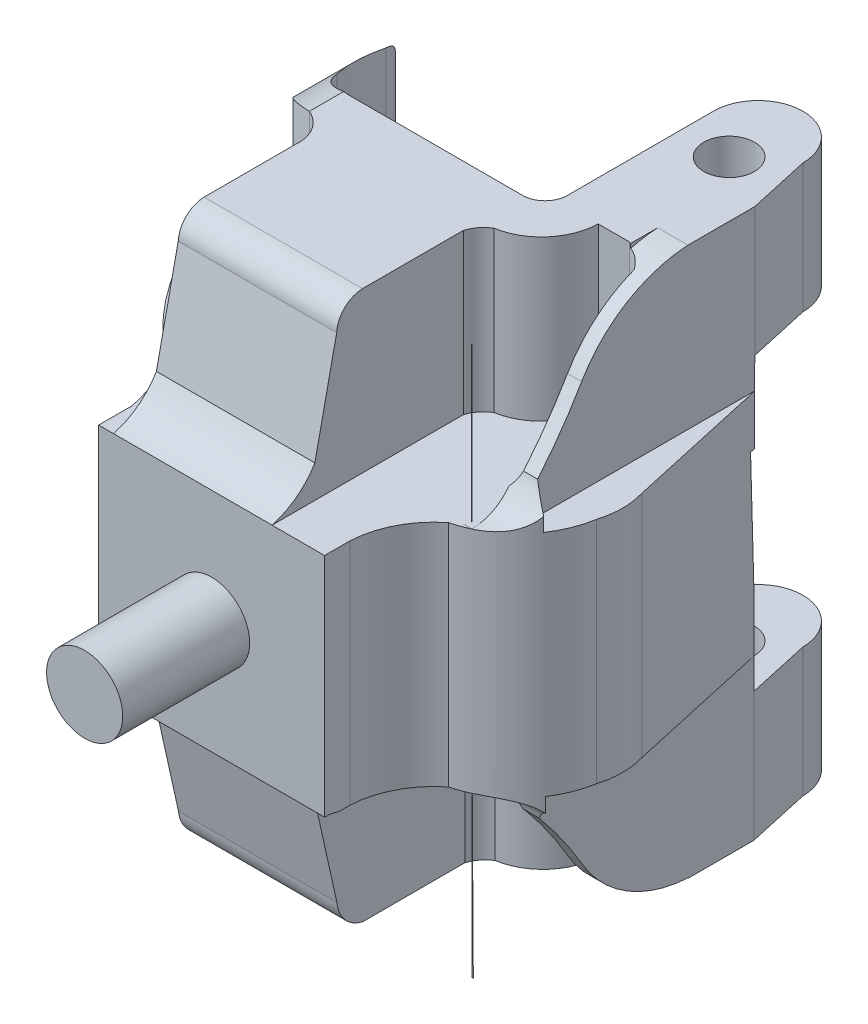
from build123d import *

# Parameters (mm, degrees)
BOSS_EXTRUDE1_DEPTH      = 431.8
CUT_EXTRUDE1_DEPTH       = 190.5
CUT_EXTRUDE1_DEPTH_BACK  = 190.5
CUT_EXTRUDE2_DEPTH       = 125.73
CUT_EXTRUDE4_DEPTH       = 128.27
CUT_EXTRUDE4_DEPTH_BACK  = 120.65
CUT_EXTRUDE5_DEPTH       = 125.73
CUT_EXTRUDE7_DEPTH       = 161.29
CUT_EXTRUDE8_DEPTH       = 45.72
CUT_EXTRUDE9_DEPTH       = 104.14
CUT_EXTRUDE9_DEPTH_BACK  = 88.9
SKETCH12_R               = 20
CUT_EXTRUDE10_DEPTH      = 431.8
CUT_EXTRUDE11_DEPTH      = 76.2
CUT_EXTRUDE11_DEPTH_BACK = 88.9
SCALE1_SCALE             = 0.1
SKETCH15_W               = 19.461471877
SKETCH15_H               = 23.114052007
CUT_EXTRUDE12_DEPTH      = 38.04
SKETCH16_R               = 3
BOSS_EXTRUDE3_DEPTH      = 10


with BuildPart() as part:
    # Sketch2 → Boss-Extrude1 (new body)
    with BuildSketch(Plane(origin=(0, 0, 0), x_dir=(1, 0, 0), z_dir=(0, 1, 0))):
        with BuildLine():
            Line((-79.244298522, 0), (55.440912384, 0))
            ThreePointArc((55.440912384, 0), (68.327741041, 4.288291197), (74.467971072, 16.4026368))
            Line((74.467971072, 16.4026368), (74.467971072, 72.827707392))
            Line((74.467971072, 72.827707392), (74.467971072, 132.581872657))
            ThreePointArc((74.467971072, 132.581872657), (109.746022134, 167.859923719), (145.024073196, 132.581872657))
            Line((145.024073196, 132.581872657), (181.17312, -30.23334015))
            ThreePointArc((181.17312, -30.23334015), (183.82679773, -48.184385864), (181.17312, -66.135431578))
            ThreePointArc((181.17312, -66.135431578), (162.228077841, -104.747606276), (125.184924058, -126.602111877))
            ThreePointArc((125.184924058, -126.602111877), (106.407786564, -149.335868365), (98.730751427, -177.804582912))
            Line((98.730751427, -177.804582912), (98.730751427, -544.478753158))
            Line((98.730751427, -544.478753158), (106.407786564, -544.478753158))
            Line((106.407786564, -544.478753158), (106.407786564, -578.332354391))
            Line((106.407786564, -578.332354391), (-88.206932207, -578.332354391))
            Line((-88.206932207, -578.332354391), (-88.206932207, -544.478753158))
            Line((-88.206932207, -544.478753158), (-79.244298522, -544.478753158))
            Line((-79.244298522, -544.478753158), (-79.244298522, -171.952122102))
            ThreePointArc((-79.244298522, -171.952122102), (-88.206932207, -144.660352565), (-104.399502705, -120.933360599))
            ThreePointArc((-104.399502705, -120.933360599), (-152.176796458, -66.428157812), (-181.17312, 0))
            ThreePointArc((-181.17312, 0), (-181.323655947, 48.230174732), (-174.314101801, 95.9485))
            ThreePointArc((-174.314101801, 95.9485), (-170.720922927, 102.895856482), (-163.921391124, 106.761482404))
            ThreePointArc((-163.921391124, 106.761482404), (-145.58136446, 101.830499971), (-136.054979803, 85.401283278))
            ThreePointArc((-136.054979803, 85.401283278), (-126.311948352, 53.883000562), (-113.17819392, 23.620262719))
            ThreePointArc((-113.17819392, 23.620262719), (-99.916901574, 6.486425919), (-79.244298522, 0))
        make_face()
    extrude(amount=BOSS_EXTRUDE1_DEPTH)

    # Sketch3 → Cut-Extrude1 (cut, two sides: drawn at the far end of the back side and taken through both)
    with BuildSketch(Plane(origin=(0, 0, 0), x_dir=(0, 0, -1), z_dir=(1, 0, 0)).offset(-CUT_EXTRUDE1_DEPTH_BACK)):
        with BuildLine():
            Line((-204.28108922, 127), (-544.478753158, 127))
            Line((-544.478753158, 127), (-544.478753158, 100.52839733))
            Line((-544.478753158, 100.52839733), (-578.332354391, 100.52839733))
            Line((-578.332354391, 100.52839733), (-578.332354391, 0))
            Line((-578.332354391, 0), (-126.602111877, 0))
            ThreePointArc((-126.602111877, 0), (-140.566602846, 8.233208943), (-146.973522261, 23.12428416))
            Line((-146.973522261, 23.12428416), (-164.165792349, 100.52839733))
            ThreePointArc((-164.165792349, 100.52839733), (-178.868176776, 121.87961231), (-204.28108922, 127))
        make_face()
        with BuildLine():
            Line((-204.28108922, 304.8), (-544.478753158, 304.8))
            Line((-544.478753158, 304.8), (-544.478753158, 331.668917397))
            Line((-544.478753158, 331.668917397), (-578.332354391, 331.668917397))
            Line((-578.332354391, 331.668917397), (-578.332354391, 431.8))
            Line((-578.332354391, 431.8), (-126.602111877, 431.8))
            ThreePointArc((-126.602111877, 431.8), (-140.684053109, 425.838191425), (-146.973522261, 411.89951114))
            Line((-146.973522261, 411.89951114), (-164.165792349, 331.668917397))
            ThreePointArc((-164.165792349, 331.668917397), (-181.197219127, 313.716309403), (-204.28108922, 304.8))
        make_face()
    extrude(amount=CUT_EXTRUDE1_DEPTH + CUT_EXTRUDE1_DEPTH_BACK, mode=Mode.SUBTRACT)

    # Sketch4 → Cut-Extrude2 (cut)
    with BuildSketch(Plane(origin=(0, 431.8, 0), x_dir=(1, 0, 0), z_dir=(0, 1, 0))):
        Polygon((155.84555549, -87.211031478), (155.84555549, 83.841944542), (226.394952987, -1.684543468), (177.876923144, -101.374053541), align=None)
        with BuildLine():
            Line((57.318052164, -164.165792349), (57.318052164, -47.130284905))
            ThreePointArc((57.318052164, -47.130284905), (61.348404683, -39.477358819), (67.773769346, -33.687219957))
            ThreePointArc((67.773769346, -33.687219957), (94.808127688, -18.527489601), (106.050536967, 10.356453845))
            Line((106.050536967, 10.356453845), (130.534952263, 10.356453845))
            ThreePointArc((130.534952263, 10.356453845), (138.616208532, 6.545433697), (144.697974326, 0))
            Line((144.697974326, 0), (144.697974326, -87.211031478))
            Line((144.697974326, -87.211031478), (138.616208532, -92.687338339))
            Line((138.616208532, -92.687338339), (138.616208532, -164.165792349))
            Line((138.616208532, -164.165792349), (138.616208532, -204.28108922))
            Line((138.616208532, -204.28108922), (57.318052164, -204.28108922))
            Line((57.318052164, -204.28108922), (57.318052164, -164.165792349))
        make_face()
        with BuildLine():
            Line((-174.314101801, 95.9485), (-160.803012267, 93.363428502))
            ThreePointArc((-160.803012267, 93.363428502), (-150.960378938, 80.465137541), (-146.941851349, 64.745888939))
            ThreePointArc((-146.941851349, 64.745888939), (-140.774296617, 37.783553429), (-131.885618608, 11.591996185))
            ThreePointArc((-131.885618608, 11.591996185), (-111.728690537, -11.869907513), (-84.566029991, -26.666952706))
            ThreePointArc((-84.566029991, -26.666952706), (-71.496208015, -37.684459203), (-67.501620029, -54.305198138))
            Line((-67.501620029, -54.305198138), (-67.501620029, -164.165792349))
            Line((-67.501620029, -164.165792349), (-67.501620029, -204.28108922))
            Line((-67.501620029, -204.28108922), (-94.807796549, -204.28108922))
            Line((-94.807796549, -204.28108922), (-106.074933908, -164.165792349))
            Line((-106.074933908, -164.165792349), (-212.544008295, 0))
            Line((-212.544008295, 0), (-212.544008295, 95.9485))
            Line((-212.544008295, 95.9485), (-174.314101801, 95.9485))
        make_face()
    extrude(amount=-CUT_EXTRUDE2_DEPTH, mode=Mode.SUBTRACT)

    # Sketch6 → Cut-Extrude4 (cut, two sides: drawn at the far end of the back side and taken through both)
    with BuildSketch(Plane.XY.offset(-CUT_EXTRUDE4_DEPTH_BACK)):
        with BuildLine():
            Line((-181.17312, 306.07), (-200.286673994, 306.07))
            Line((-200.286673994, 306.07), (-200.286673994, 431.8))
            Line((-200.286673994, 431.8), (-84.566029991, 431.8))
            ThreePointArc((-84.566029991, 431.8), (-123.973907642, 408.523503999), (-146.941851349, 368.935))
            ThreePointArc((-146.941851349, 368.935), (-151.793508278, 351.084070168), (-160.803012267, 334.927860566))
            ThreePointArc((-160.803012267, 334.927860566), (-168.44948447, 318.707003198), (-181.17312, 306.07))
        make_face()
        with BuildLine():
            Line((-181.17312, 126.127314727), (-200.286673994, 126.127314727))
            Line((-200.286673994, 126.127314727), (-200.286673994, 0.397314727))
            Line((-200.286673994, 0.397314727), (-200.286673994, -9.335489314))
            Line((-200.286673994, -9.335489314), (-84.566029991, -9.335489314))
            Line((-84.566029991, -9.335489314), (-84.566029991, 0.397314727))
            ThreePointArc((-84.566029991, 0.397314727), (-123.973907642, 23.673810728), (-146.941851349, 63.262314727))
            ThreePointArc((-146.941851349, 63.262314727), (-151.793508278, 81.113244559), (-160.803012267, 97.26945416))
            ThreePointArc((-160.803012267, 97.26945416), (-168.44948447, 113.490311529), (-181.17312, 126.127314727))
        make_face()
    extrude(amount=CUT_EXTRUDE4_DEPTH + CUT_EXTRUDE4_DEPTH_BACK, mode=Mode.SUBTRACT)

    # Sketch7 → Cut-Extrude5 (cut)
    with BuildSketch(Plane(origin=(0, 0, 0), x_dir=(1, 0, 0), z_dir=(0, 1, 0))):
        Polygon((156.049496363, -86.308866012), (156.049496363, 84.744110008), (226.598893859, -0.782378002), (178.080864016, -100.471888075), align=None)
        with BuildLine():
            Line((57.521993037, -163.263626883), (57.521993037, -46.228119439))
            ThreePointArc((57.521993037, -46.228119439), (61.552345555, -38.575193353), (67.977710219, -32.785054491))
            ThreePointArc((67.977710219, -32.785054491), (95.01206856, -17.625324135), (106.25447784, 11.258619311))
            Line((106.25447784, 11.258619311), (130.738893135, 11.258619311))
            ThreePointArc((130.738893135, 11.258619311), (138.820149404, 7.447599163), (144.901915198, 0.902165466))
            Line((144.901915198, 0.902165466), (144.901915198, -86.308866012))
            Line((144.901915198, -86.308866012), (138.820149404, -91.785172873))
            Line((138.820149404, -91.785172873), (138.820149404, -163.263626883))
            Line((138.820149404, -163.263626883), (138.820149404, -203.378923754))
            Line((138.820149404, -203.378923754), (57.521993037, -203.378923754))
            Line((57.521993037, -203.378923754), (57.521993037, -163.263626883))
        make_face()
        with BuildLine():
            Line((-174.110160928, 96.850665466), (-160.599071394, 94.265593968))
            ThreePointArc((-160.599071394, 94.265593968), (-150.756438066, 81.367303007), (-146.737910477, 65.648054405))
            ThreePointArc((-146.737910477, 65.648054405), (-140.570355744, 38.685718895), (-131.681677735, 12.494161651))
            ThreePointArc((-131.681677735, 12.494161651), (-111.524749665, -10.967742047), (-84.362089119, -25.76478724))
            ThreePointArc((-84.362089119, -25.76478724), (-71.292267142, -36.782293737), (-67.297679156, -53.403032672))
            Line((-67.297679156, -53.403032672), (-67.297679156, -163.263626883))
            Line((-67.297679156, -163.263626883), (-67.297679156, -203.378923754))
            Line((-67.297679156, -203.378923754), (-94.603855676, -203.378923754))
            Line((-94.603855676, -203.378923754), (-105.870993035, -163.263626883))
            Line((-105.870993035, -163.263626883), (-212.340067422, 0.902165466))
            Line((-212.340067422, 0.902165466), (-212.340067422, 96.850665466))
            Line((-212.340067422, 96.850665466), (-174.110160928, 96.850665466))
        make_face()
    extrude(amount=CUT_EXTRUDE5_DEPTH, mode=Mode.SUBTRACT)

    # Sketch8 → Cut-Extrude7 (cut)
    with BuildSketch(Plane(origin=(0, 0, 0), x_dir=(0, 0, -1), z_dir=(1, 0, 0))):
        Polygon((167.859923719, 215.9), (167.859923719, 101.6), (82.923395382, 101.6), (83.841944542, 330.2), (167.859923719, 330.2), align=None)
    extrude(amount=CUT_EXTRUDE7_DEPTH, mode=Mode.SUBTRACT)

    # Sketch9 → Cut-Extrude8 (cut)
    with BuildSketch(Plane(origin=(177.8, 0, 0), x_dir=(0, 0, -1), z_dir=(1, 0, 0))):
        with BuildLine():
            Line((31.13006407, 431.8), (31.13006407, 493.405620114))
            Line((31.13006407, 493.405620114), (-121.748062484, 493.405620114))
            Line((-121.748062484, 493.405620114), (-121.892848155, 306.07))
            ThreePointArc((-121.892848155, 306.07), (-100.412110743, 313.016001375), (-87.211031478, 331.329944727))
            ThreePointArc((-87.211031478, 331.329944727), (-68.814678471, 355.183985364), (-52.549790031, 380.539348952))
            ThreePointArc((-52.549790031, 380.539348952), (-17.173940566, 416.721882811), (31.13006407, 431.8))
        make_face()
        with BuildLine():
            Line((-121.360940458, -61.527139811), (-121.767097148, 125.808095964))
            ThreePointArc((-121.767097148, 125.808095964), (-100.276689563, 118.892071333), (-87.050071484, 100.596563986))
            ThreePointArc((-87.050071484, 100.596563986), (-68.62045516, 76.768213208), (-52.320206679, 51.435567114))
            ThreePointArc((-52.320206679, 51.435567114), (-16.893909677, 15.302424951), (31.431084974, 0.291716314))
            Line((31.431084974, 0.291716314), (31.517037301, -61.313843839))
            Line((31.517037301, -61.313843839), (-121.360940458, -61.527139811))
        make_face()
    extrude(amount=-CUT_EXTRUDE8_DEPTH, mode=Mode.SUBTRACT)


with BuildPart() as cut_extrude8_piece_1:
    # of the separate pieces the step leaves, piece 1, a body of its own (cut_extrude8_pieces)
    add(part.part.solids().sort_by_distance((-113.17819392, 14.385260939, -23.620262719))[0])

    # Sketch10 → Cut-Extrude9 (cut, two sides: drawn at the far end of the back side and taken through both)
    with BuildSketch(Plane(origin=(0, 0, 0), x_dir=(0, 0, -1), z_dir=(1, 0, 0)).offset(-CUT_EXTRUDE9_DEPTH_BACK)):
        with BuildLine():
            Line((-428.983201738, 193.229592666), (-514.334244368, 193.275834301))
            ThreePointArc((-514.334244368, 193.275834301), (-537.128372855, 216.094675062), (-514.309532095, 238.888803549))
            Line((-514.309532095, 238.888803549), (-428.958489465, 238.842561914))
            ThreePointArc((-428.958489465, 238.842561914), (-406.164360977, 216.023721154), (-428.983201738, 193.229592666))
        make_face()
    extrude(amount=CUT_EXTRUDE9_DEPTH + CUT_EXTRUDE9_DEPTH_BACK, mode=Mode.SUBTRACT)

    # Sketch12 → Cut-Extrude10 (cut)
    with BuildSketch(Plane(origin=(0, 0, 0), x_dir=(1, 0, 0), z_dir=(0, 1, 0))):
        with Locations(Location((111.812353192, 107.656197962, 0), (0, 0, 270))):
            Circle(SKETCH12_R)
    extrude(amount=CUT_EXTRUDE10_DEPTH, mode=Mode.SUBTRACT)

    # Sketch13 → Cut-Extrude11 (cut, two sides: drawn at the far end of the back side and taken through both)
    with BuildSketch(Plane.XY.offset(-CUT_EXTRUDE11_DEPTH_BACK)):
        with BuildLine():
            Line((156.793476245, 266.763254357), (-63.998127701, 266.763254357))
            ThreePointArc((-63.998127701, 266.763254357), (-113.494417347, 215.963254357), (-63.998127701, 165.163254357))
            Line((-63.998127701, 165.163254357), (155.992789689, 165.163254357))
            Line((155.992789689, 165.163254357), (156.793476245, 266.763254357))
        make_face()
    extrude(amount=CUT_EXTRUDE11_DEPTH + CUT_EXTRUDE11_DEPTH_BACK, mode=Mode.SUBTRACT)


with BuildPart() as cut_extrude8_piece_2:
    # of the separate pieces the step leaves, piece 2, a body of its own (cut_extrude8_pieces)
    add(part.part.solids().sort_by_distance((138.825981411, 431.8, 121.795675485))[0])


with BuildPart() as cut_extrude8_piece_2_1:
    # Scale1: scaled about (0, 0, 0)
    add(cut_extrude8_piece_2.part.scale(SCALE1_SCALE))


with BuildPart() as cut_extrude8_piece_1_1:
    # Scale1: scaled about (0, 0, 0)
    add(cut_extrude8_piece_1.part.scale(SCALE1_SCALE))

    # Sketch15 → Cut-Extrude12 (cut)
    with BuildSketch(Plane.XY.offset(57.833235439)):
        with Locations((0.910042717, 21.609865737)):
            Rectangle(SKETCH15_W, SKETCH15_H)
    extrude(amount=-CUT_EXTRUDE12_DEPTH, mode=Mode.SUBTRACT)

    # Sketch16 → Boss-Extrude3 (add)
    with BuildSketch(Plane.XY.offset(19.793235439)):
        with Locations((0.974322645, 21.683189332)):
            Circle(SKETCH16_R)
    extrude(amount=BOSS_EXTRUDE3_DEPTH)


solid = Compound([cut_extrude8_piece_2_1.part, cut_extrude8_piece_1_1.part])
